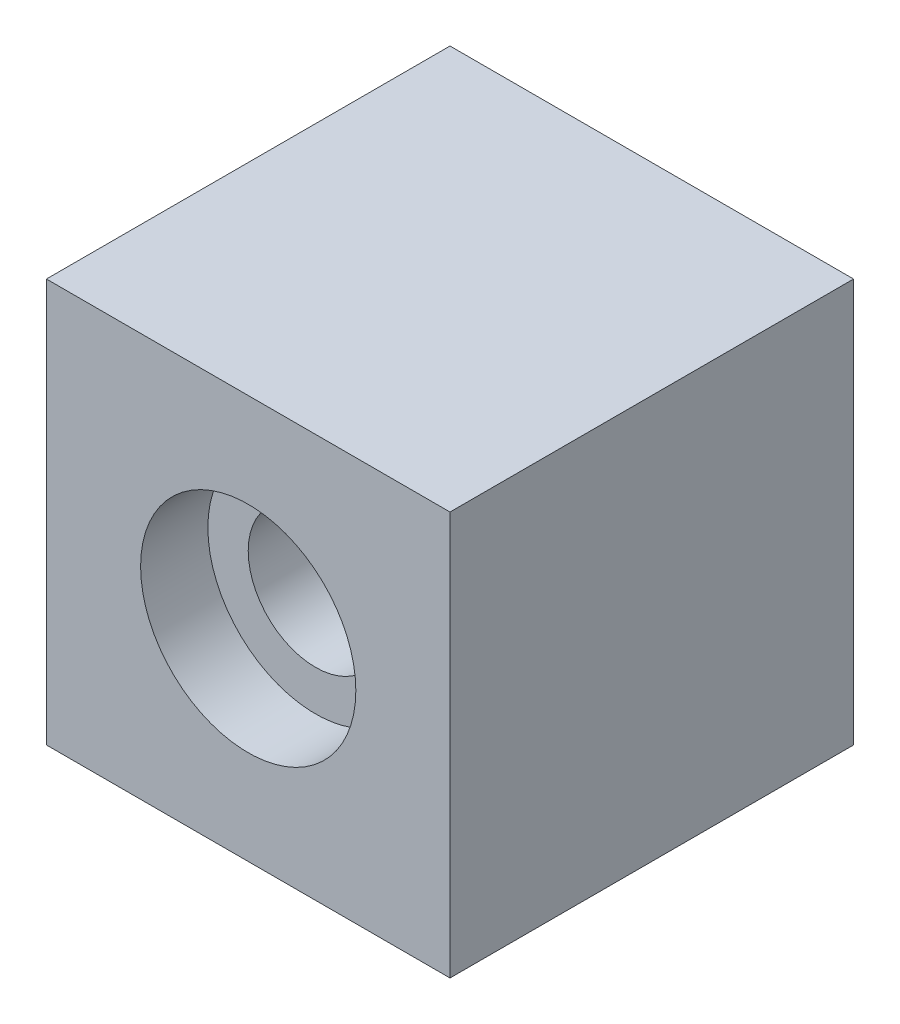
from build123d import *

# Parameters (mm, degrees)
SKETCH_1_W          = 30
SKETCH_1_H          = 30
SKETCH_1_R          = 5
EXTRUDE_1_DEPTH     = 15
SKETCH_3_R          = 8
CUT_EXTRUDE_1_DEPTH = 5


with BuildPart() as part:
    # 草圖1 → 填料-伸長1 (new, symmetric)
    with BuildSketch(Plane.XY):
        with Locations((15, 15)):
            Rectangle(SKETCH_1_W, SKETCH_1_H)
        with Locations((15, 15)):
            Circle(SKETCH_1_R, mode=Mode.SUBTRACT)
    extrude(amount=EXTRUDE_1_DEPTH, both=True)

    # 草圖3 → 除料-伸長1 (cut)
    with BuildSketch(Plane.XY.offset(15)):
        with Locations((15, 15)):
            Circle(SKETCH_3_R)
    cut_extrude_1 = extrude(amount=-CUT_EXTRUDE_1_DEPTH, mode=Mode.SUBTRACT)

    # 鏡射1: 除料-伸長1 across plane
    add(cut_extrude_1.mirror(Plane.XY), mode=Mode.SUBTRACT)


solid = part.part
